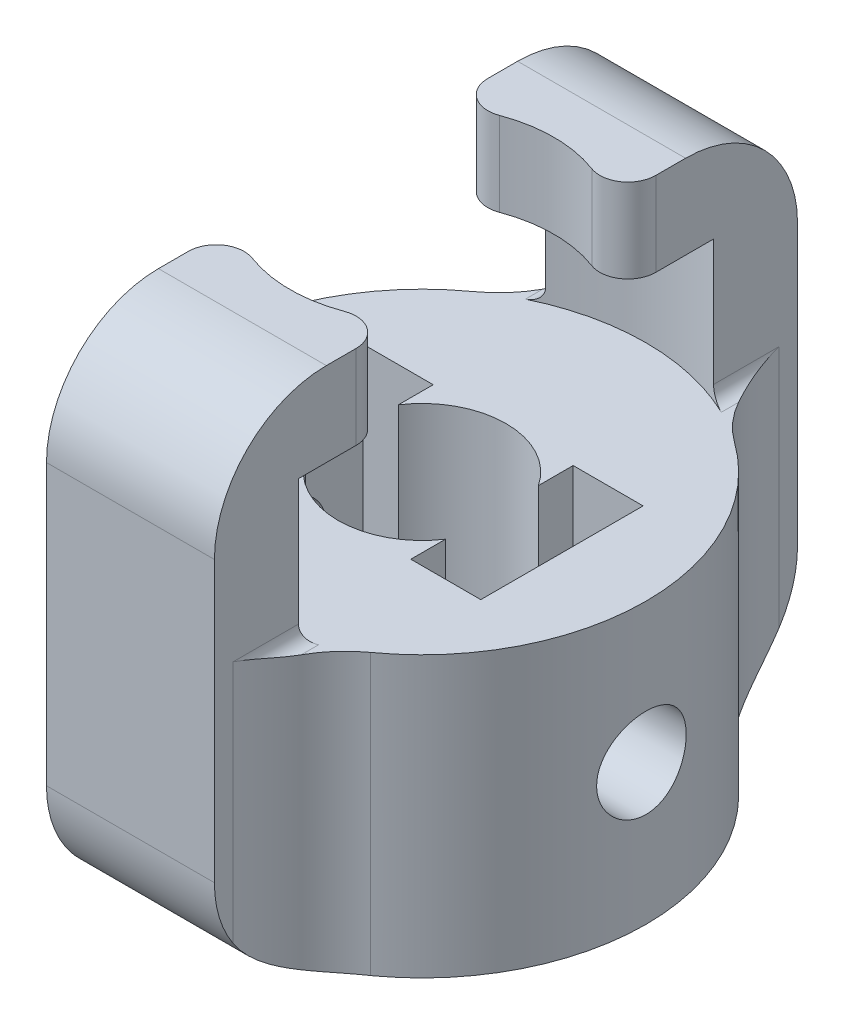
from build123d import *

# Parameters (mm, degrees)
SKETCH1_R               = 8
SKETCH1_R_2             = 3
BOSS_EXTRUDE1_DEPTH     = 10
BOSS_EXTRUDE2_DEPTH     = 15
BOSS_EXTRUDE3_DEPTH     = 3
FILLET1_R               = 4
FILLET2_R               = 4
FILLET3_R               = 0.5
FILLET4_R               = 1
CUT_EXTRUDE1_DEPTH      = 56.872699751
CUT_EXTRUDE1_DEPTH_BACK = 56.872699751
SKETCH5_R               = 1.6
CUT_EXTRUDE2_REACH      = 55.831
SKETCH6_W               = 2.5
SKETCH6_H               = 5.8


with BuildPart() as part:
    # Sketch1 → Boss-Extrude1 (new body)
    with BuildSketch(Plane(origin=(0, 0, 0), x_dir=(1, 0, 0), z_dir=(0, 1, 0))):
        with Locations((-42.590141196, -5.023885001)):
            Circle(SKETCH1_R)
        with Locations((-42.590141196, -5.023885001)):
            Circle(SKETCH1_R_2, mode=Mode.SUBTRACT)
    extrude(amount=BOSS_EXTRUDE1_DEPTH)

    # Sketch2 → Boss-Extrude2 (add)
    with BuildSketch(Plane(origin=(0, 0, 0), x_dir=(1, 0, 0), z_dir=(0, 1, 0))):
        with BuildLine():
            Line((-39.590141196, -12.440083488), (-39.590141196, -15.440083488))
            Line((-39.590141196, -15.440083488), (-45.590141196, -15.440083488))
            Line((-45.590141196, -15.440083488), (-45.590141196, -12.440083488))
            ThreePointArc((-45.590141196, -12.440083488), (-42.590141196, -13.023885001), (-39.590141196, -12.440083488))
        make_face()
        with BuildLine():
            Line((-45.590141196, 5.392313486), (-45.590141196, 2.392313486))
            ThreePointArc((-45.590141196, 2.392313486), (-42.590141196, 2.976114999), (-39.590141196, 2.392313486))
            Line((-39.590141196, 2.392313486), (-39.590141196, 5.392313486))
            Line((-39.590141196, 5.392313486), (-45.590141196, 5.392313486))
        make_face()
    extrude(amount=BOSS_EXTRUDE2_DEPTH)

    # Sketch3 → Boss-Extrude3 (add)
    with BuildSketch(Plane(origin=(0, 15, 0), x_dir=(1, 0, 0), z_dir=(0, 1, 0))):
        with BuildLine():
            Line((-39.590141196, -15.440083488), (-45.590141196, -15.440083488))
            Line((-45.590141196, -15.440083488), (-45.590141196, -8.660434161))
            ThreePointArc((-45.590141196, -8.660434161), (-42.590141196, -9.738170715), (-39.590141196, -8.660434161))
            Line((-39.590141196, -8.660434161), (-39.590141196, -15.440083488))
        make_face()
        with BuildLine():
            Line((-45.590141196, 5.392313486), (-45.590141196, -1.38733584))
            ThreePointArc((-45.590141196, -1.38733584), (-42.590141196, -0.309599286), (-39.590141196, -1.38733584))
            Line((-39.590141196, -1.38733584), (-39.590141196, 5.392313486))
            Line((-39.590141196, 5.392313486), (-45.590141196, 5.392313486))
        make_face()
    extrude(amount=BOSS_EXTRUDE3_DEPTH)

    # Fillet1
    fillet1_edges = [part.edges().sort_by_distance(p)[0] for p in [
        (-39.590141196, 5, -2.392313486),
        (-39.590141196, 5, 12.440083488),
        (-45.590141196, 5, 12.440083488),
        (-45.590141196, 5, -2.392313486),
    ]]
    fillet(fillet1_edges, radius=FILLET1_R)

    # Fillet2
    fillet2_edges = [part.edges().sort_by_distance(p)[0] for p in [
        (-42.590141196, 18, 15.440083488),
        (-42.590141196, 18, -5.392313486),
        (-42.590141196, 0, -5.392313486),
        (-42.590141196, 0, 15.440083488),
    ]]
    fillet(fillet2_edges, radius=FILLET2_R)

    # Fillet3
    fillet3_edges = [part.edges().sort_by_distance(p)[0] for p in [
        (-39.590141196, 10, 13.605381417),
        (-45.590141196, 10, 13.605381417),
        (-45.590141196, 10, -3.557611415),
        (-39.590141196, 10, -3.557611415),
    ]]
    fillet(fillet3_edges, radius=FILLET3_R)

    # Fillet4
    fillet4_edges = [part.edges().sort_by_distance(p)[0] for p in [
        (-39.590141196, 16.5, 8.660434161),
        (-45.590141196, 16.5, 8.660434161),
        (-39.590141196, 16.5, 1.38733584),
        (-45.590141196, 16.5, 1.38733584),
    ]]
    fillet(fillet4_edges, radius=FILLET4_R)

    # Sketch5 → Cut-Extrude1 (cut, two sides: drawn at the far end of the back side and taken through both)
    with BuildSketch(Plane(origin=(0, 0, 0), x_dir=(0, 0, -1), z_dir=(1, 0, 0)).offset(-CUT_EXTRUDE1_DEPTH_BACK)):
        with Locations((-5.023885001, 5)):
            Circle(SKETCH5_R)
    extrude(amount=CUT_EXTRUDE1_DEPTH + CUT_EXTRUDE1_DEPTH_BACK, mode=Mode.SUBTRACT)

    # Sketch6 → Cut-Extrude2 (cut, up to next)
    with BuildSketch(Plane(origin=(0, 10, 0), x_dir=(1, 0, 0), z_dir=(0, 1, 0)), mode=Mode.PRIVATE) as cut_extrude2_sk1:
        with Locations((-38.840141196, -5.023885001)):
            Rectangle(SKETCH6_W, SKETCH6_H)
    cut_extrude2_tool1 = extrude(cut_extrude2_sk1.sketch, amount=-CUT_EXTRUDE2_REACH, mode=Mode.PRIVATE) & part.part
    # Sketch6 → Cut-Extrude2 (cut, up to next)
    with BuildSketch(Plane(origin=(0, 10, 0), x_dir=(1, 0, 0), z_dir=(0, 1, 0)), mode=Mode.PRIVATE) as cut_extrude2_sk2:
        with Locations((-46.340141196, -5.023885001)):
            Rectangle(SKETCH6_W, SKETCH6_H)
    cut_extrude2_tool2 = extrude(cut_extrude2_sk2.sketch, amount=-CUT_EXTRUDE2_REACH, mode=Mode.PRIVATE) & part.part
    add(cut_extrude2_tool1.solids().sort_by_distance((-38.840141, 10, 5.023885))[0], mode=Mode.SUBTRACT)
    add(cut_extrude2_tool2.solids().sort_by_distance((-46.340141, 10, 5.023885))[0], mode=Mode.SUBTRACT)


solid = part.part
